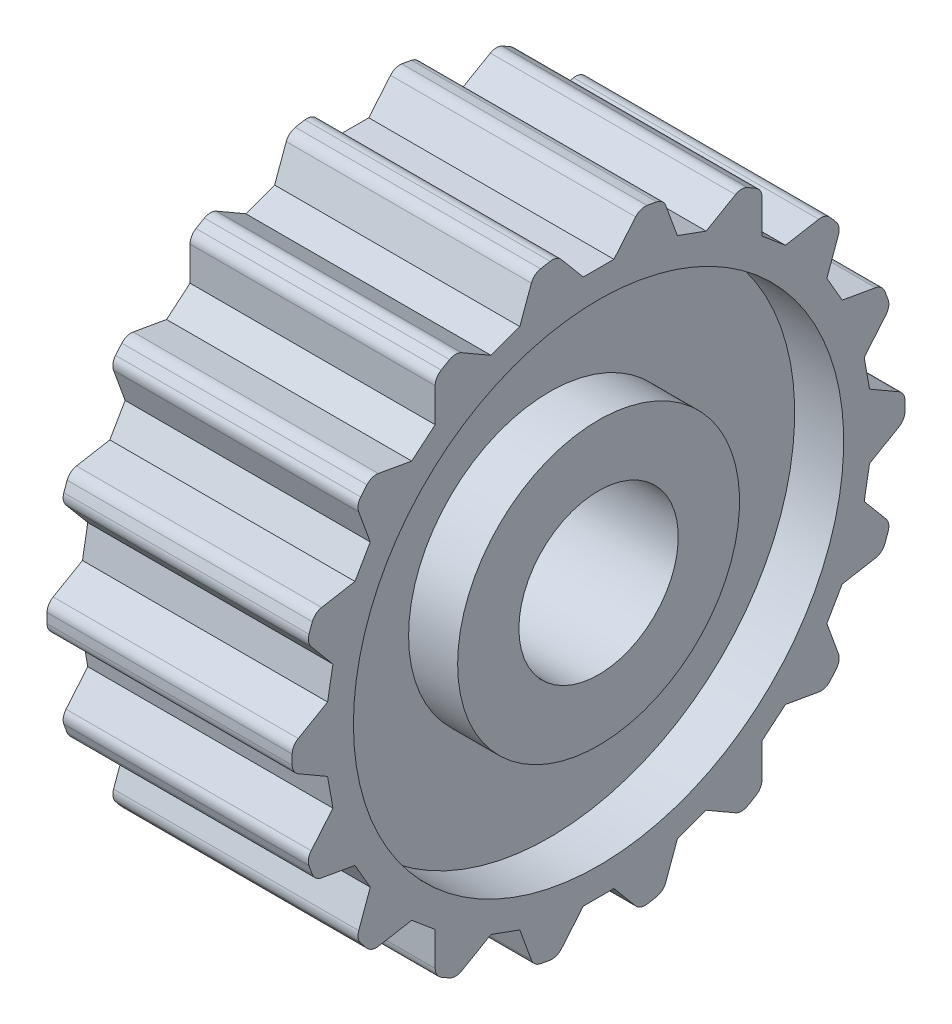
from build123d import *

# Parameters (mm, degrees)
CUT_EXTRUDE1_DEPTH       = 19.66511184
FILLET2_R                = 0.508
CIRPATTERN1_COUNT        = 18
FILLET2_OF_CIRPATTERN1_R = 0.508


with BuildPart() as part:
    # Sketch1 → Revolve1 (revolve)
    with BuildSketch(Plane.XY, mode=Mode.PRIVATE) as revolve1_sk:
        Polygon((5.08, 5.842), (3.048, 5.842), (3.048, 10.16), (5.08, 10.16), (5.08, 12.7), (-5.08, 12.7), (-5.08, 10.16), (-3.048, 10.16), (-3.048, 5.842), (-5.08, 5.842), (-5.08, 3.302), (5.08, 3.302), align=None)
    revolve(revolve1_sk.sketch.rotate(Axis((0, 0, 0), (1, 0, 0)), 90), axis=Axis((0, 0, 0), (1, 0, 0)))

    # Sketch2 → Cut-Extrude1 (cut, symmetric)
    with BuildSketch(Plane(origin=(0, 0, 0), x_dir=(0, 0, -1), z_dir=(1, 0, 0))):
        Polygon((0.635, 11.291535111), (1.991281675, 12.906814359), (-1.991281675, 12.906814359), (-0.635, 11.291535111), align=None)
    cut_extrude1 = extrude(amount=CUT_EXTRUDE1_DEPTH, both=True, mode=Mode.SUBTRACT)

    # Fillet2
    fillet2_edges = [part.edges().sort_by_distance(p)[0] for p in [
        (0, 12.583064675, 1.719442756),
        (0, 12.583064675, -1.719442756),
    ]]
    fillet(fillet2_edges, radius=FILLET2_R)

    # CirPattern1: Cut-Extrude1 ×18 about axis
    cirpattern1_axis = Axis((0, 0, 0), (1, 0, 0))
    for i in range(1, CIRPATTERN1_COUNT):
        add(cut_extrude1.rotate(cirpattern1_axis, i * 360 / CIRPATTERN1_COUNT), mode=Mode.SUBTRACT)

    # Fillet2 of CirPattern1
    fillet2_of_cirpattern1_edges = [part.edges().sort_by_distance(p)[0] for p in [
        (0, 11.236128964, 5.919409254),
        (0, 12.41229708, 2.687913913),
        (0, 8.533950272, 9.405407634),
        (0, 10.744423271, 6.771068496),
        (0, 4.80245123, 11.756975044),
        (0, 7.780613445, 10.037532288),
        (0, 0.491705693, 12.69047775),
        (0, 3.878346808, 12.093321547),
        (0, -3.878346808, 12.093321547),
        (0, -0.491705693, 12.69047775),
        (0, -7.780613445, 10.037532288),
        (0, -4.80245123, 11.756975044),
        (0, -10.744423271, 6.771068496),
        (0, -8.533950272, 9.405407634),
        (0, -12.41229708, 2.687913913),
        (0, -11.236128964, 5.919409254),
        (0, -12.583064675, -1.719442756),
        (0, -12.583064675, 1.719442756),
        (0, -11.236128964, -5.919409254),
        (0, -12.41229708, -2.687913913),
        (0, -8.533950272, -9.405407634),
        (0, -10.744423271, -6.771068496),
        (0, -4.80245123, -11.756975044),
        (0, -7.780613445, -10.037532288),
        (0, -0.491705693, -12.69047775),
        (0, -3.878346808, -12.093321547),
        (0, 3.878346808, -12.093321547),
        (0, 0.491705693, -12.69047775),
        (0, 7.780613445, -10.037532288),
        (0, 4.80245123, -11.756975044),
        (0, 10.744423271, -6.771068496),
        (0, 8.533950272, -9.405407634),
        (0, 12.41229708, -2.687913913),
        (0, 11.236128964, -5.919409254),
    ]]
    fillet(fillet2_of_cirpattern1_edges, radius=FILLET2_OF_CIRPATTERN1_R)


solid = part.part
